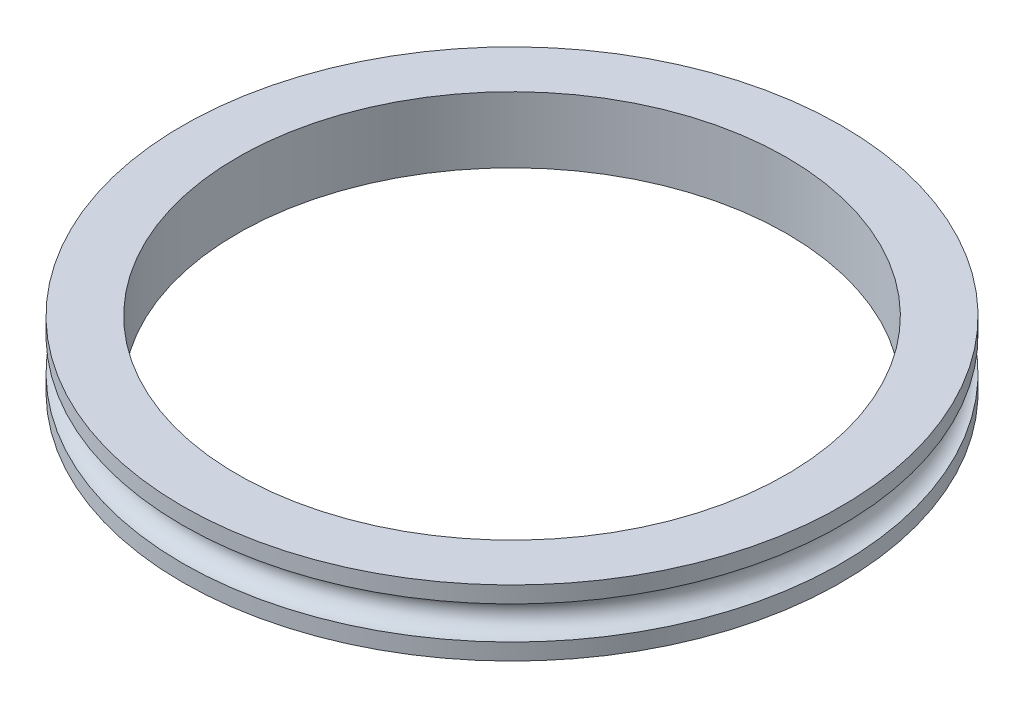
from build123d import *

# Parameters (mm, degrees)
CROQUIS1_R              = 15
SALIENTE_EXTRUIR1_DEPTH = 1.5
CROQUIS2_R              = 0.75
CROQUIS4_R              = 12.5
CORTAR_EXTRUIR1_DEPTH   = 22.424285286


with BuildPart() as part:
    # Croquis1 → Saliente-Extruir1 (new, symmetric)
    with BuildSketch(Plane(origin=(0, 0, 0), x_dir=(1, 0, 0), z_dir=(0, 1, 0))):
        with Locations(Location((0, 0, 0), (0, 0, 270))):
            Circle(CROQUIS1_R)
    extrude(amount=SALIENTE_EXTRUIR1_DEPTH, both=True)

    # Croquis2 → Cortar-Revolución1 (revolve, cut)
    with BuildSketch(Plane(origin=(0, 0, 0), x_dir=(0, 0, -1), z_dir=(1, 0, 0)), mode=Mode.PRIVATE) as cortar_revoluci_n1_sk:
        with Locations((15, 0)):
            Circle(CROQUIS2_R)
    revolve(cortar_revoluci_n1_sk.sketch.rotate(Axis((0, 1.5, 0), (0, -1, 0)), 180), axis=Axis((0, 1.5, 0), (0, -1, 0)), mode=Mode.SUBTRACT)

    # Croquis4 → Cortar-Extruir1 (cut, through all)
    with BuildSketch(Plane.XZ.offset(1.5)):
        with Locations(Location((0, 0, 0), (0, 0, 270))):
            Circle(CROQUIS4_R)
    extrude(amount=-CORTAR_EXTRUIR1_DEPTH, mode=Mode.SUBTRACT)


solid = part.part
